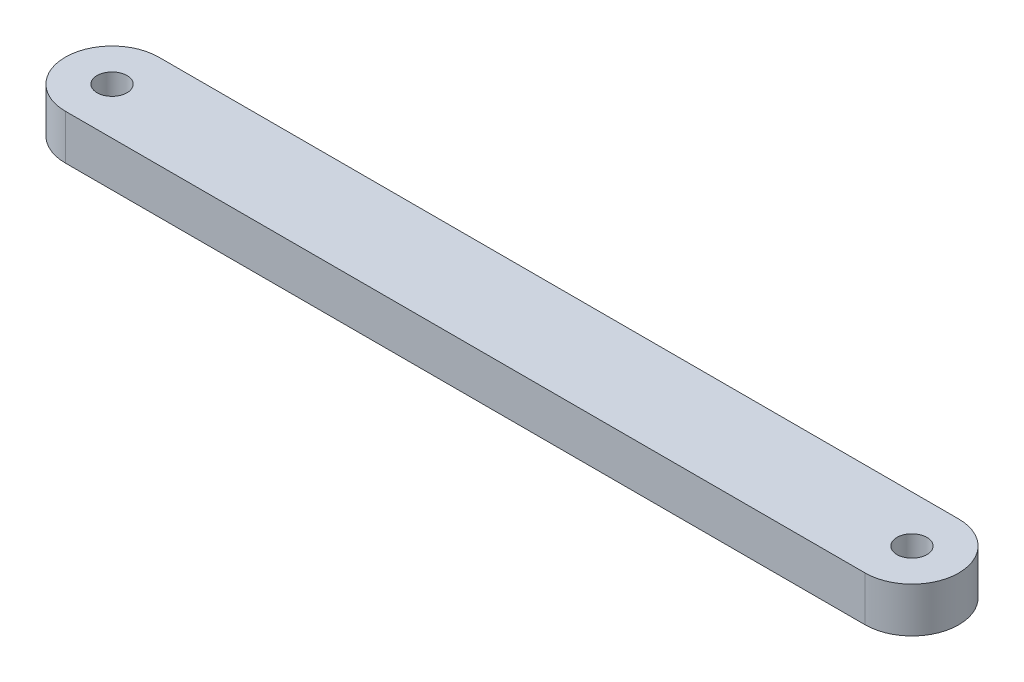
from build123d import *

# Parameters (mm, degrees)
SKETCH_1_R      = 1.6
EXTRUDE_1_DEPTH = 4.8


with BuildPart() as part:
    # ｽｹｯﾁ1 → ﾎﾞｽ - 押し出し1 (new body)
    with BuildSketch(Plane(origin=(0, 0, 0), x_dir=(1, 0, 0), z_dir=(0, 1, 0))):
        with BuildLine():
            Line((-42.75, 5), (42.75, 5))
            ThreePointArc((42.75, 5), (47.75, 0), (42.75, -5))
            Line((42.75, -5), (-42.75, -5))
            ThreePointArc((-42.75, -5), (-47.75, 0), (-42.75, 5))
        make_face()
        with Locations(Location((-42.75, 0, 0), (0, 0, 270))):
            Circle(SKETCH_1_R, mode=Mode.SUBTRACT)
        with Locations(Location((42.75, 0, 0), (0, 0, 270))):
            Circle(SKETCH_1_R, mode=Mode.SUBTRACT)
    extrude(amount=EXTRUDE_1_DEPTH)


solid = part.part
